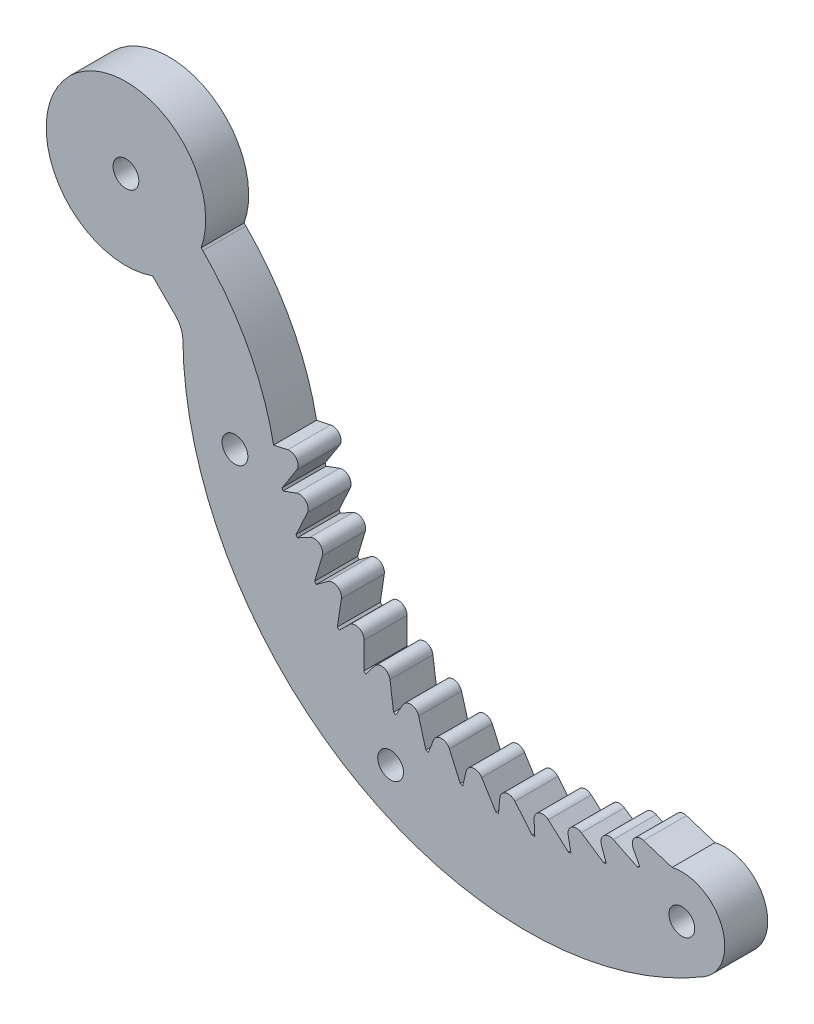
from build123d import *

# Parameters (mm, degrees)
ESQUISSE1_R             = 3.5
BOSS_EXTRU_1_DEPTH      = 5
ESQUISSE2_R             = 3.5
ESQUISSE2_R_2           = 1.5
BOSS_EXTRU_2_DEPTH      = 5
ESQUISSE3_R             = 1.5
ENL_V_MAT_EXTRU_1_DEPTH = 52.599228309
BOSS_EXTRU_3_DEPTH      = 5


with BuildPart() as part:
    # Esquisse1 → Boss.-Extru.1 (new body)
    with BuildSketch(Plane.XY):
        with BuildLine():
            Line((-26.278959381, 12.43097678), (-23.625738837, 9.777756236))
            ThreePointArc((-23.625738837, 9.777756236), (-22.982271103, 8.820887218), (-22.747269794, 7.691983578))
            ThreePointArc((-22.747269794, 7.691983578), (-2.226699014, -26.772009928), (37.87835279, -26.104557126))
            ThreePointArc((37.87835279, -26.104557126), (39.583612673, -19.242189551), (32.721245099, -17.536929668))
            ThreePointArc((32.721245099, -17.536929668), (5.06736173, -19.249102003), (-12.195220044, 2.422816923))
            ThreePointArc((-12.195220044, 2.422816923), (-15.15644736, 10.772312527), (-20.427158676, 17.892884575))
            Line((-20.427158676, 17.892884575), (-20.622105131, 18.08783103))
            ThreePointArc((-20.622105131, 18.08783103), (-35.933936854, 27.742808503), (-26.278959381, 12.43097678))
        make_face()
        with Locations((-29.371809148, 21.180680797)):
            Circle(ESQUISSE1_R, mode=Mode.SUBTRACT)
    extrude(amount=BOSS_EXTRU_1_DEPTH)

    # Esquisse2 → Boss.-Extru.2 (add, through all)
    with BuildSketch(Plane.XY.offset(5)):
        with Locations((-29.371809148, 21.180680797)):
            Circle(ESQUISSE2_R)
        with Locations((-29.371809148, 21.180680797)):
            Circle(ESQUISSE2_R_2, mode=Mode.SUBTRACT)
    extrude(amount=-BOSS_EXTRU_2_DEPTH)

    # Esquisse3 → Enlèv. mat.-Extru.1 (cut, through all)
    with BuildSketch(Plane.XY.offset(5)):
        with Locations((35.299798944, -21.820743397)):
            Circle(ESQUISSE3_R)
        with Locations((1.420331358, -23.010555966)):
            Circle(ESQUISSE3_R)
        with Locations((-16.690323797, -0.244656241)):
            Circle(ESQUISSE3_R)
    extrude(amount=-ENL_V_MAT_EXTRU_1_DEPTH, mode=Mode.SUBTRACT)

    # Esquisse4 → Boss.-Extru.3 (add, through all)
    with BuildSketch(Plane(origin=(0, 0, 0), x_dir=(-1, 0, 0), z_dir=(0, 0, -1))):
        with BuildLine():
            ThreePointArc((-32.721245099, -17.536929668), (-31.583474438, -18.188350077), (-30.418328753, -18.789437557))
            Line((-30.418328753, -18.789437557), (-29.651415378, -17.296811968))
            ThreePointArc((-29.651415378, -17.296811968), (-29.778275742, -16.192937164), (-30.846670439, -15.887706259))
            Line((-30.846670439, -15.887706259), (-33.82002484, -16.842679657))
            Line((-33.82002484, -16.842679657), (-34.160934368, -16.952171997))
            ThreePointArc((-34.160934368, -16.952171997), (-33.418234352, -17.188280263), (-32.721245099, -17.536929668))
        make_face()
        with BuildLine():
            ThreePointArc((-30.141880226, -18.922742606), (-28.344838513, -19.707023958), (-26.500403555, -20.372242602))
            Line((-26.500403555, -20.372242602), (-25.950815291, -18.786670146))
            ThreePointArc((-25.950815291, -18.786670146), (-26.231514379, -17.711569612), (-27.332196648, -17.559478592))
            Line((-27.332196648, -17.559478592), (-30.141880226, -18.922742606))
        make_face()
        with BuildLine():
            ThreePointArc((-26.207967618, -20.465383608), (-24.318558502, -20.989396346), (-22.398954871, -21.388868572))
            Line((-22.398954871, -21.388868572), (-22.07759519, -19.741805965))
            ThreePointArc((-22.07759519, -19.741805965), (-22.506564116, -18.716808992), (-23.617697141, -18.720875242))
            Line((-23.617697141, -18.720875242), (-26.207967618, -20.465383608))
        make_face()
        with BuildLine():
            ThreePointArc((-22.096333261, -21.439997678), (-20.152041379, -21.693345733), (-18.195352752, -21.819146273))
            Line((-18.195352752, -21.819146273), (-18.108597219, -20.143270158))
            ThreePointArc((-18.108597219, -20.143270158), (-18.677325521, -19.188712012), (-19.776865153, -19.348854862))
            Line((-19.776865153, -19.348854862), (-22.096333261, -21.439997678))
        make_face()
        with BuildLine():
            ThreePointArc((-17.888549284, -21.827249111), (-15.927948113, -21.804906224), (-13.972993908, -21.654539278))
            Line((-13.972993908, -21.654539278), (-14.122563696, -19.983097938))
            ThreePointArc((-14.122563696, -19.983097938), (-14.819768177, -19.117916427), (-15.88590027, -19.430958747))
            Line((-15.88590027, -19.430958747), (-17.888549284, -21.827249111))
        make_face()
        with BuildLine():
            ThreePointArc((-13.668095361, -21.619455093), (-11.730081941, -21.321864532), (-9.815647169, -20.898313282))
            Line((-9.815647169, -20.898313282), (-10.19857491, -19.264467016))
            ThreePointArc((-10.19857491, -19.264467016), (-11.010423491, -18.505826774), (-12.021996685, -18.96555801))
            Line((-12.021996685, -18.96555801), (-13.668095361, -21.619455093))
        make_face()
        with BuildLine():
            ThreePointArc((-9.51870253, -20.820738122), (-7.641725776, -20.253803889), (-5.805791566, -19.565471313))
            Line((-5.805791566, -19.565471313), (-6.414480226, -18.00163456))
            ThreePointArc((-6.414480226, -18.00163456), (-7.324866364, -17.364586511), (-8.261811709, -17.961885897))
            Line((-8.261811709, -17.961885897), (-9.51870253, -20.820738122))
        make_face()
        with BuildLine():
            ThreePointArc((-5.522692022, -19.446944218), (-3.743989923, -18.621913915), (-2.022980005, -17.68245608))
            Line((-2.022980005, -17.68245608), (-2.8453536, -16.219654336))
            ThreePointArc((-2.8453536, -16.219654336), (-3.836215831, -15.716837097), (-4.679944946, -16.439854603))
            Line((-4.679944946, -16.439854603), (-5.522692022, -19.446944218))
        make_face()
        with BuildLine():
            ThreePointArc((-1.759342065, -17.52532855), (-0.114202903, -16.458570238), (1.457739014, -15.286625373))
            Line((1.457739014, -15.286625373), (0.437995836, -13.953879663))
            ThreePointArc((0.437995836, -13.953879663), (-0.61368443, -13.595268797), (-1.347458283, -14.429660233))
            Line((-1.347458283, -14.429660233), (-1.759342065, -17.52532855))
        make_face()
        with BuildLine():
            Line((9.503225829, 1.258047301), (11.195220044, -1.366827201))
            ThreePointArc((11.195220044, -1.366827201), (11.75717366, 0.511646725), (12.195220044, 2.422816923))
            Line((12.195220044, 2.422816923), (10.554962651, 2.777278429))
            ThreePointArc((10.554962651, 2.777278429), (9.521535347, 2.369036904), (9.503225829, 1.258047301))
        make_face()
        with BuildLine():
            ThreePointArc((9.573674437, -5.268877882), (10.393983884, -3.487993672), (11.096209126, -1.657328255))
            Line((11.096209126, -1.657328255), (9.522025266, -1.075922675))
            ThreePointArc((9.522025266, -1.075922675), (8.44149028, -1.334915489), (8.267265601, -2.432311906))
            Line((8.267265601, -2.432311906), (9.573674437, -5.268877882))
        make_face()
        with BuildLine():
            ThreePointArc((7.419966271, -8.904390336), (8.482357148, -7.256427417), (9.43482956, -5.542585982))
            Line((9.43482956, -5.542585982), (7.957950007, -4.745771034))
            ThreePointArc((7.957950007, -4.745771034), (6.851744443, -4.850376889), (6.525061109, -5.912408496))
            Line((6.525061109, -5.912408496), (7.419966271, -8.904390336))
        make_face()
        with BuildLine():
            ThreePointArc((4.776823702, -12.201238381), (6.060218871, -10.718891256), (7.244042024, -9.155875293))
            Line((7.244042024, -9.155875293), (5.893767102, -8.159459262))
            ThreePointArc((5.893767102, -8.159459262), (4.783837353, -8.107602847), (4.311176546, -9.113199633))
            Line((4.311176546, -9.113199633), (4.776823702, -12.201238381))
        make_face()
        with BuildLine():
            ThreePointArc((1.696684946, -15.094014714), (3.175622689, -13.806692179), (4.567310309, -12.425510899))
            Line((4.567310309, -12.425510899), (3.370428584, -11.249262026))
            ThreePointArc((3.370428584, -11.249262026), (2.278794929, -11.041972137), (1.66953393, -11.971183722))
            Line((1.66953393, -11.971183722), (1.696684946, -15.094014714))
        make_face()
    extrude(amount=-BOSS_EXTRU_3_DEPTH)


solid = part.part
